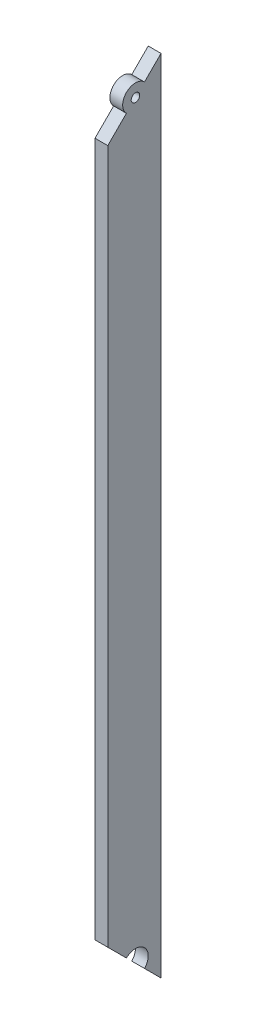
from build123d import *

# Parameters (mm, degrees)
BOSS_EXTRUDE1_DEPTH = 6
SKETCH4_R           = 6
BOSS_EXTRUDE2_DEPTH = 6
SKETCH3_R           = 2
SKETCH3_R_2         = 6
CUT_EXTRUDE1_DEPTH  = 377.877964333


with BuildPart() as part:
    # Sketch2 → Boss-Extrude1 (new body)
    with BuildSketch(Plane(origin=(0, 0, 0), x_dir=(0, 0, -1), z_dir=(1, 0, 0))):
        Polygon((0, 376), (0, 0), (-25, 25), (-25, 351), align=None)
    extrude(amount=BOSS_EXTRUDE1_DEPTH)

    # Sketch4 → Boss-Extrude2 (add)
    with BuildSketch(Plane(origin=(6, 0, 0), x_dir=(0, 0, -1), z_dir=(1, 0, 0))):
        with Locations((-12, 364)):
            Circle(SKETCH4_R)
    extrude(amount=-BOSS_EXTRUDE2_DEPTH)

    # Sketch3 → Cut-Extrude1 (cut, through all)
    with BuildSketch(Plane(origin=(6, 0, 0), x_dir=(0, 0, -1), z_dir=(1, 0, 0))):
        with Locations((-12, 364)):
            Circle(SKETCH3_R)
        with Locations((-12, 12)):
            Circle(SKETCH3_R_2)
    extrude(amount=-CUT_EXTRUDE1_DEPTH, mode=Mode.SUBTRACT)


solid = part.part
